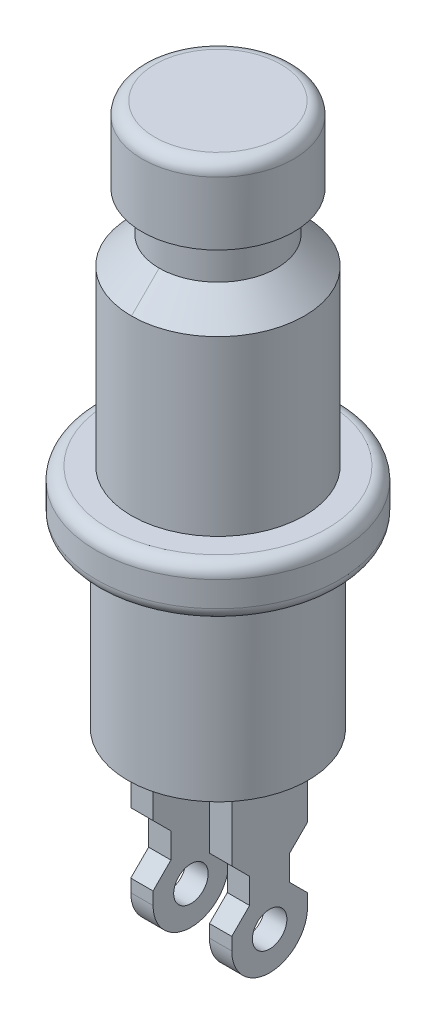
from build123d import *

# Parameters (mm, degrees)
SKETCH1_R           = 4.815
BOSS_EXTRUDE1_DEPTH = 2
SKETCH2_R           = 3.575
BOSS_EXTRUDE2_DEPTH = 7
SKETCH3_R           = 3.425
BOSS_EXTRUDE3_DEPTH = 6.85
SKETCH4_R           = 2.33
BOSS_EXTRUDE4_DEPTH = 5
SKETCH6_R           = 3
BOSS_EXTRUDE5_DEPTH = 0.67
BOSS_EXTRUDE6_START = 2.33
SKETCH7_R           = 3
SKETCH7_R_2         = 2.444387837
BOSS_EXTRUDE6_DEPTH = 2.33
SKETCH8_R           = 0.683030706
BOSS_EXTRUDE7_DEPTH = 2
SKETCH9_W           = 2.23373787
SKETCH9_H           = 6.792121548
CUT_EXTRUDE1_DEPTH  = 23.571638177
FILLET2_R           = 0.5
FILLET3_R           = 0.5


with BuildPart() as part:
    # Sketch1 → Boss-Extrude1 (new body)
    with BuildSketch(Plane(origin=(0, 0, 0), x_dir=(1, 0, 0), z_dir=(0, 1, 0))):
        with Locations(Location((0, 0, 0), (0, 0, 270))):
            Circle(SKETCH1_R)
    extrude(amount=-BOSS_EXTRUDE1_DEPTH)

    # Sketch2 → Boss-Extrude2 (add)
    with BuildSketch(Plane.XZ.offset(2)):
        with Locations(Location((0, 0, 0), (0, 0, 90))):
            Circle(SKETCH2_R)
    extrude(amount=BOSS_EXTRUDE2_DEPTH)

    # Sketch3 → Boss-Extrude3 (add)
    with BuildSketch(Plane(origin=(0, 0, 0), x_dir=(1, 0, 0), z_dir=(0, 1, 0))):
        with Locations(Location((0, 0, 0), (0, 0, 90))):
            Circle(SKETCH3_R)
    extrude(amount=BOSS_EXTRUDE3_DEPTH)

    # Sketch4 → Boss-Extrude4 (add)
    with BuildSketch(Plane(origin=(0, 6.85, 0), x_dir=(1, 0, 0), z_dir=(0, 1, 0))):
        with Locations(Location((0, 0, 0), (0, 0, 270))):
            Circle(SKETCH4_R)
    extrude(amount=BOSS_EXTRUDE4_DEPTH)

    # Sweep1: sweep along a curve in space
    with BuildLine() as sweep1_path:
        ThreePointArc((0, 6.85, 2.33), (1.6475588, 6.85, 1.6475588), (2.33, 6.85, 0))
        ThreePointArc((2.33, 6.85, 0), (1.6475588, 6.85, -1.6475588), (0, 6.85, -2.33))
        ThreePointArc((0, 6.85, -2.33), (-1.6475588, 6.85, -1.6475588), (-2.33, 6.85, 0))
        ThreePointArc((-2.33, 6.85, 0), (-1.6475588, 6.85, 1.6475588), (0, 6.85, 2.33))
    # Sketch5 → Sweep1 (sweep)
    with BuildSketch(Plane.XY):
        Polygon((-3.425, 6.85), (-2.33, 7.945), (-2.33, 6.85), align=None)
    sweep(path=sweep1_path.line)

    # Sketch6 → Boss-Extrude5 (add)
    with BuildSketch(Plane(origin=(0, 11.85, 0), x_dir=(1, 0, 0), z_dir=(0, 1, 0))):
        with Locations(Location((0, 0, 0), (0, 0, 270))):
            Circle(SKETCH6_R)
    extrude(amount=BOSS_EXTRUDE5_DEPTH)

    # Sketch7 → Boss-Extrude6 (add)
    with BuildSketch(Plane.XZ.offset(-11.85).offset(BOSS_EXTRUDE6_START)):
        with Locations(Location((0, 0, 0), (0, 0, 270))):
            Circle(SKETCH7_R)
        with Locations(Location((0, 0, 0), (0, 0, 270))):
            Circle(SKETCH7_R_2, mode=Mode.SUBTRACT)
    extrude(amount=-BOSS_EXTRUDE6_DEPTH)

    # Sketch8 → Boss-Extrude7 (add, symmetric)
    with BuildSketch(Plane(origin=(0, 0, 0), x_dir=(0, 0, -1), z_dir=(1, 0, 0))):
        with BuildLine():
            Line((-1.452989765, -9), (1.547010235, -9))
            Line((1.547010235, -9), (1.547010235, -12))
            Line((1.547010235, -12), (0.839903454, -12.707106781))
            Line((0.839903454, -12.707106781), (0.839903454, -13.707106781))
            Line((0.839903454, -13.707106781), (1.547010235, -14.414213562))
            Line((1.547010235, -14.414213562), (1.547010235, -14.914213562))
            ThreePointArc((1.547010235, -14.914213562), (0.047010235, -16.414213562), (-1.452989765, -14.914213562))
            Line((-1.452989765, -14.914213562), (-1.452989765, -14.414213562))
            Line((-1.452989765, -14.414213562), (-0.745882984, -13.707106781))
            Line((-0.745882984, -13.707106781), (-0.745882984, -12.707106781))
            Line((-0.745882984, -12.707106781), (-1.452989765, -12))
            Line((-1.452989765, -12), (-1.452989765, -9))
        make_face()
        with Locations((0.047010235, -14.914213562)):
            Circle(SKETCH8_R, mode=Mode.SUBTRACT)
    extrude(amount=BOSS_EXTRUDE7_DEPTH, both=True)

    # Sketch9 → Cut-Extrude1 (cut, through all)
    with BuildSketch(Plane.XZ.offset(9)):
        Rectangle(SKETCH9_W, SKETCH9_H)
    extrude(amount=CUT_EXTRUDE1_DEPTH, mode=Mode.SUBTRACT)

    # Fillet2
    fillet2_edges = [part.edges().sort_by_distance(p)[0] for p in [
        (0, 0, -4.815),
        (0, -2, -4.815),
    ]]
    fillet(fillet2_edges, radius=FILLET2_R)

    # Fillet3
    fillet3_edges = [part.edges().sort_by_distance(p)[0] for p in [
        (0, 12.52, -3),
    ]]
    fillet(fillet3_edges, radius=FILLET3_R)


solid = part.part
